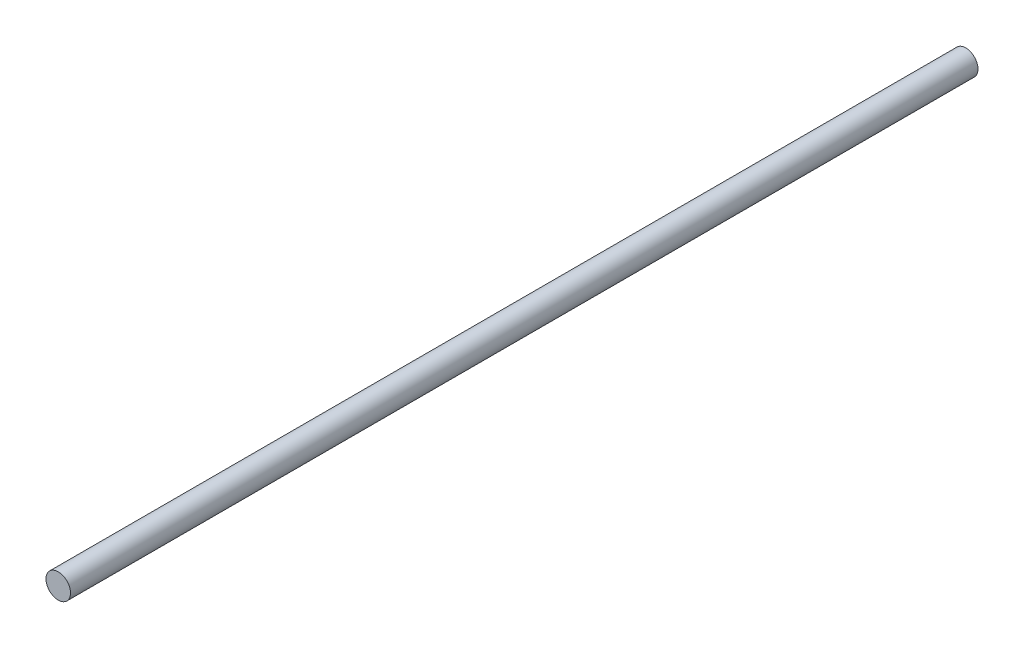
from build123d import *

# Parameters (mm, degrees)
SKETCH2_W = 295.8
SKETCH2_H = 4


with BuildPart() as part:
    # Sketch2 → Revolve1 (revolve)
    with BuildSketch(Plane(origin=(0, 0, 0), x_dir=(0, 0, -1), z_dir=(1, 0, 0)), mode=Mode.PRIVATE) as revolve1_sk:
        with Locations((130, 2)):
            Rectangle(SKETCH2_W, SKETCH2_H)
    revolve(revolve1_sk.sketch.rotate(Axis((0, 0, 17.9), (0, 0, -1)), 90), axis=Axis((0, 0, 17.9), (0, 0, -1)))


solid = part.part
